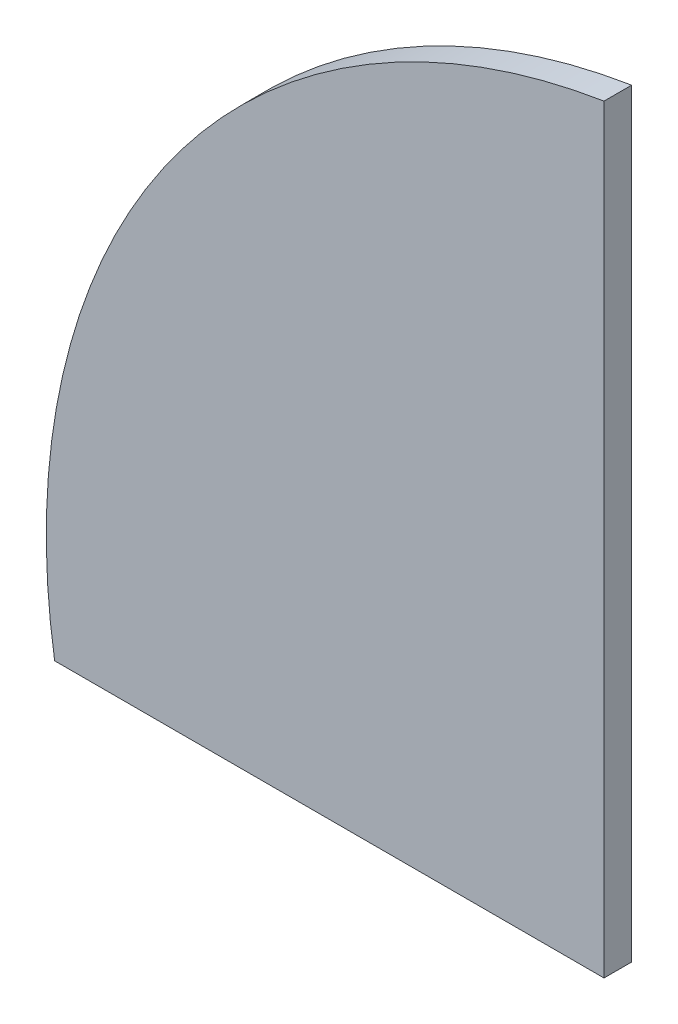
from build123d import *

# Parameters (mm, degrees)
BOSS_EXTRUDE1_DEPTH = 10


with BuildPart() as part:
    # Sketch1 → Boss-Extrude1 (new body)
    with BuildSketch(Plane.XY):
        with BuildLine():
            Line((-226.844543996, -37.967787126), (-236.977735538, -37.967787126))
            ThreePointArc((-236.977735538, -37.967787126), (-194.455098656, 140.667034541), (-38.100019678, 236.956511834))
            Line((-38.100019678, 236.956511834), (-38.100019678, -37.967787126))
            Line((-38.100019678, -37.967787126), (-226.844543996, -37.967787126))
        make_face()
    extrude(amount=BOSS_EXTRUDE1_DEPTH)


solid = part.part
